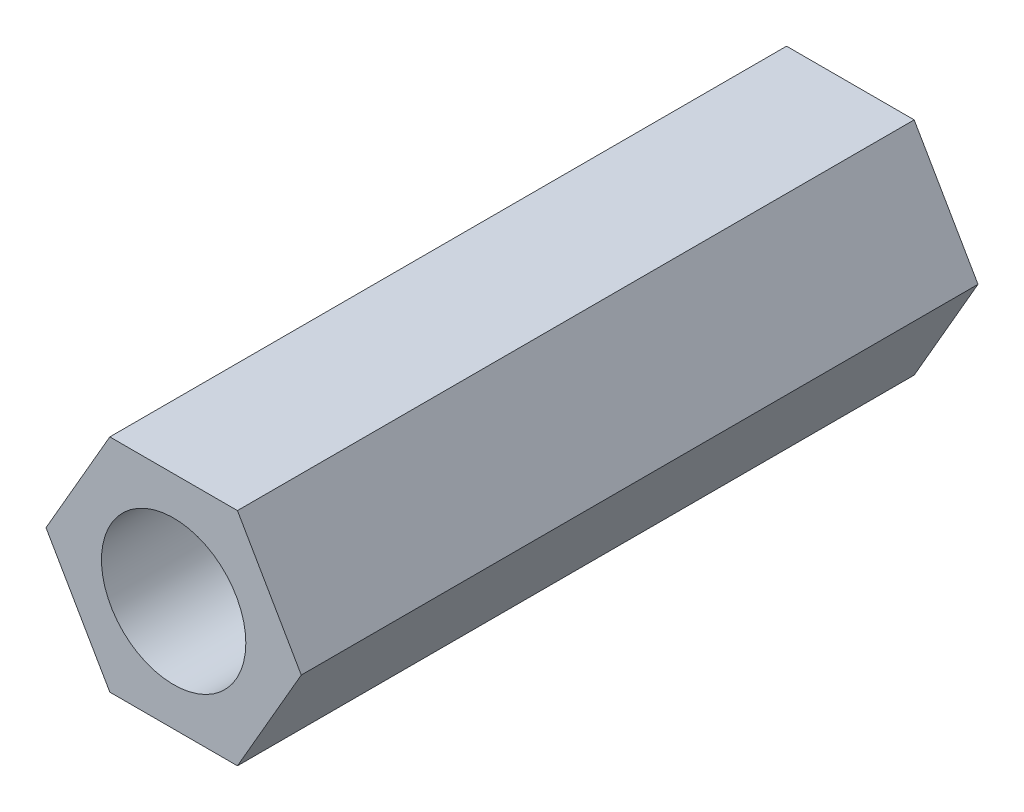
from build123d import *

# Parameters (mm, degrees)
SKETCH_1_R      = 1.6
EXTRUDE_1_DEPTH = 15


with BuildPart() as part:
    # 草图1 → 凸台-拉伸1 (new body)
    with BuildSketch(Plane.XY):
        Polygon((2.829016319, 0), (1.41450816, 2.45), (-1.41450816, 2.45), (-2.829016319, 0), (-1.41450816, -2.45), (1.41450816, -2.45), align=None)
        Circle(SKETCH_1_R, mode=Mode.SUBTRACT)
    extrude(amount=EXTRUDE_1_DEPTH)


solid = part.part
